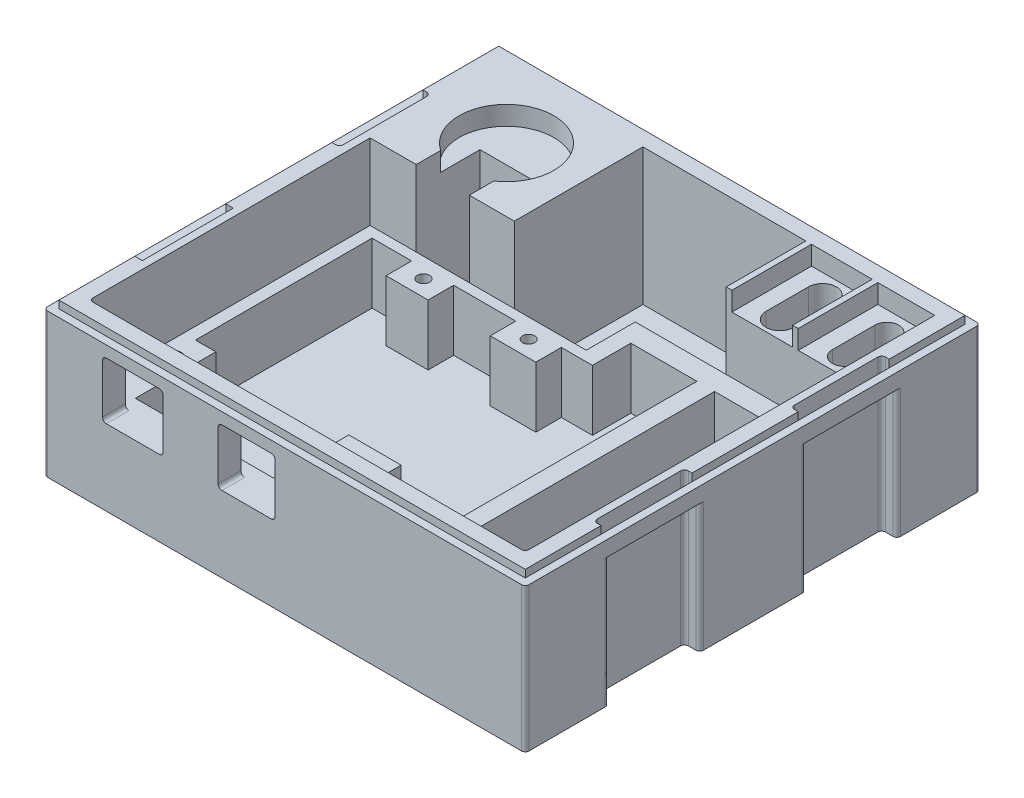
from build123d import *

# Parameters (mm, degrees)
CROQUIS1_W                       = 127
CROQUIS1_H                       = 120
SALIENTE_EXTRUIR1_DEPTH          = 40
CROQUIS2_W                       = 115
CROQUIS2_H                       = 108
CORTAR_EXTRUIR1_DEPTH            = 20
CROQUIS15_W                      = 16
CROQUIS15_H                      = 15
CORTAR_EXTRUIR3_DEPTH            = 14
REDONDEO4_R                      = 1
REDONDEO5_R                      = 1
TALADRO_DE_MARGEN_PARA_M31_D     = 3.2
TALADRO_DE_MARGEN_PARA_M31_DEPTH = 15
TALADRO_DE_MARGEN_PARA_M31_TIP   = 0.96137699
SALIENTE_EXTRUIR4_DEPTH          = 15
CROQUIS22_W                      = 1.5
CROQUIS22_H                      = 21
SALIENTE_EXTRUIR5_DEPTH          = 5
CROQUIS24_W                      = 38.033070537
CROQUIS24_H                      = 33.923090476
CROQUIS24_R                      = 12.5
SALIENTE_EXTRUIR8_DEPTH          = 5
CROQUIS25_W                      = 14
CROQUIS25_H                      = 6.45894104
CORTAR_EXTRUIR4_DEPTH            = 5
CROQUIS27_W                      = 14
CROQUIS27_H                      = 16.815098629
CORTAR_EXTRUIR5_DEPTH            = 84.1
CROQUIS28_W                      = 15
CROQUIS28_H                      = 15
CORTAR_EXTRUIR6_DEPTH            = 10
REDONDEO7_R                      = 1
CROQUIS32_OUTSIDE_W              = 164.85
CROQUIS32_OUTSIDE_H              = 157.85
CROQUIS32_OUTSIDE_W_2            = 123
CROQUIS32_OUTSIDE_H_2            = 116
CORTAR_EXTRUIR7_DEPTH            = 2
CROQUIS34_W                      = 24
CROQUIS34_H                      = 34
CORTAR_EXTRUIR8_DEPTH            = 4
CROQUIS35_W                      = 2
CROQUIS35_H                      = 24
CORTAR_EXTRUIR9_DEPTH            = 20
REDONDEO13_R                     = 1
REDONDEO19_R                     = 1
REDONDEO14_R                     = 1
CROQUIS36_R                      = 2.5
CORTAR_EXTRUIR10_DEPTH           = 1
CORTAR_EXTRUIR14_DEPTH           = 39
CROQUIS45_W                      = 25.554294357
CROQUIS45_H                      = 77.944282849
CORTAR_EXTRUIR15_DEPTH           = 16
CORTAR_EXTRUIR16_DEPTH           = 31


with BuildPart() as part:
    # Croquis1 → Saliente-Extruir1 (new body)
    with BuildSketch(Plane(origin=(0, 0, 0), x_dir=(1, 0, 0), z_dir=(0, 1, 0))):
        with Locations((12.465540006, -22.149251677)):
            Rectangle(CROQUIS1_W, CROQUIS1_H)
    extrude(amount=SALIENTE_EXTRUIR1_DEPTH)

    # Croquis2 → Cortar-Extruir1 (cut)
    with BuildSketch(Plane(origin=(0, 40, 0), x_dir=(1, 0, 0), z_dir=(0, 1, 0))):
        with Locations((12.465540006, -22.149251677)):
            Rectangle(CROQUIS2_W, CROQUIS2_H)
    extrude(amount=-CORTAR_EXTRUIR1_DEPTH, mode=Mode.SUBTRACT)

    # Croquis15 → Cortar-Extruir3 (cut)
    with BuildSketch(Plane(origin=(0, 0, 76.149251677), x_dir=(-1, 0, 0), z_dir=(0, 0, -1))):
        with Locations((27.534459994, 27.5)):
            Rectangle(CROQUIS15_W, CROQUIS15_H)
    extrude(amount=-CORTAR_EXTRUIR3_DEPTH, mode=Mode.SUBTRACT)

    # Redondeo4
    redondeo4_edges = [part.edges().sort_by_distance(p)[0] for p in [
        (-35.534459994, 35, 79.149251677),
        (-35.534459994, 20, 79.149251677),
        (-19.534459994, 20, 79.149251677),
        (-19.534459994, 35, 79.149251677),
    ]]
    fillet(redondeo4_edges, radius=REDONDEO4_R)

    # Redondeo5
    redondeo5_edges = [part.edges().sort_by_distance(p)[0] for p in [
        (-45.034459994, 30, 76.149251677),
        (69.965540006, 30, 76.149251677),
    ]]
    fillet(redondeo5_edges, radius=REDONDEO5_R)

    # Taladro de margen para M31
    with Locations(Plane(origin=(0, 20, 0), x_dir=(1, 0, 0), z_dir=(0, 1, 0))):
        with Locations((-41.034459994, -57.549251677), (6.965509678, -59.149251677), (-25.815009056, -7.199797633), (1.865509678, -7.156454516)):
            Hole(TALADRO_DE_MARGEN_PARA_M31_D / 2, depth=TALADRO_DE_MARGEN_PARA_M31_DEPTH)
            with Locations((0, 0, -(TALADRO_DE_MARGEN_PARA_M31_DEPTH + TALADRO_DE_MARGEN_PARA_M31_TIP / 2))):  # 118° drill point
                Cone(0, TALADRO_DE_MARGEN_PARA_M31_D / 2, TALADRO_DE_MARGEN_PARA_M31_TIP, mode=Mode.SUBTRACT)

    # Croquis21 → Saliente-Extruir4 (add)
    with BuildSketch(Plane(origin=(0, 20, 0), x_dir=(1, 0, 0), z_dir=(0, 1, 0))):
        Polygon((-45.034459994, -2.072342153), (11.965540006, -2.072342153), (11.965540006, 10.850748323), (69.965540006, 10.850748323), (69.965540006, 31.850748323), (-45.034459994, 31.850748323), align=None)
    extrude(amount=SALIENTE_EXTRUIR4_DEPTH)

    # Croquis22 → Saliente-Extruir5 (add)
    with BuildSketch(Plane(origin=(0, 35, 0), x_dir=(1, 0, 0), z_dir=(0, 1, 0))):
        with Locations((54.215540006, 21.350748323)):
            Rectangle(CROQUIS22_W, CROQUIS22_H)
        with Locations((36.715540006, 21.350748323)):
            Rectangle(CROQUIS22_W, CROQUIS22_H)
    extrude(amount=SALIENTE_EXTRUIR5_DEPTH)

    # Croquis24 → Saliente-Extruir8 (add)
    with BuildSketch(Plane(origin=(0, 35, 0), x_dir=(1, 0, 0), z_dir=(0, 1, 0))):
        with Locations((-26.017924726, 14.889203085)):
            Rectangle(CROQUIS24_W, CROQUIS24_H)
        with Locations(Location((-25.871478116, 14.742756476, 0), (0, 0, 270))):
            Circle(CROQUIS24_R, mode=Mode.SUBTRACT)
    extrude(amount=SALIENTE_EXTRUIR8_DEPTH)

    # Croquis25 → Cortar-Extruir4 (cut)
    with BuildSketch(Plane(origin=(0, 40, 0), x_dir=(1, 0, 0), z_dir=(0, 1, 0))):
        with Locations((-25.871478116, 1.157128367)):
            Rectangle(CROQUIS25_W, CROQUIS25_H)
    extrude(amount=-CORTAR_EXTRUIR4_DEPTH, mode=Mode.SUBTRACT)

    # Croquis27 → Cortar-Extruir5 (cut)
    with BuildSketch(Plane(origin=(0, 35, 0), x_dir=(1, 0, 0), z_dir=(0, 1, 0))):
        with Locations((-25.871478116, 6.335207161)):
            Rectangle(CROQUIS27_W, CROQUIS27_H)
    extrude(amount=-CORTAR_EXTRUIR5_DEPTH, mode=Mode.SUBTRACT)

    # Croquis28 → Cortar-Extruir6 (cut)
    with BuildSketch(Plane.XY.offset(82.149251677)):
        with Locations((2.465540006, 27.5)):
            Rectangle(CROQUIS28_W, CROQUIS28_H)
    extrude(amount=-CORTAR_EXTRUIR6_DEPTH, mode=Mode.SUBTRACT)

    # Redondeo7
    redondeo7_edges = [part.edges().sort_by_distance(p)[0] for p in [
        (-5.034459994, 20, 79.149251677),
        (-5.034459994, 35, 79.149251677),
        (9.965540006, 35, 79.149251677),
        (9.965540006, 20, 79.149251677),
    ]]
    fillet(redondeo7_edges, radius=REDONDEO7_R)

    # Croquis32 outside → Cortar-Extruir7 (cut)
    with BuildSketch(Plane(origin=(0, 40, 0), x_dir=(1, 0, 0), z_dir=(0, 1, 0))):
        with Locations((12.466, -22.149)):
            Rectangle(CROQUIS32_OUTSIDE_W, CROQUIS32_OUTSIDE_H)
        with Locations((12.465540006, -22.149251677)):
            Rectangle(CROQUIS32_OUTSIDE_W_2, CROQUIS32_OUTSIDE_H_2, mode=Mode.SUBTRACT)
    extrude(amount=-CORTAR_EXTRUIR7_DEPTH, mode=Mode.SUBTRACT)

    # Croquis34 → Cortar-Extruir8 (cut)
    with BuildSketch(Plane(origin=(75.965540006, 0, 0), x_dir=(0, 0, -1), z_dir=(1, 0, 0))):
        with Locations((-48.149251677, 17)):
            Rectangle(CROQUIS34_W, CROQUIS34_H)
        with Locations((3.850748323, 17)):
            Rectangle(CROQUIS34_W, CROQUIS34_H)
    cortar_extruir8 = extrude(amount=-CORTAR_EXTRUIR8_DEPTH, mode=Mode.SUBTRACT)

    # Croquis35 → Cortar-Extruir9 (cut)
    with BuildSketch(Plane.XZ.offset(-34)):
        with Locations((72.965540006, 48.149251677)):
            Rectangle(CROQUIS35_W, CROQUIS35_H)
        with Locations((72.965540006, -3.850748323)):
            Rectangle(CROQUIS35_W, CROQUIS35_H)
    cortar_extruir9 = extrude(amount=-CORTAR_EXTRUIR9_DEPTH, mode=Mode.SUBTRACT)

    # Redondeo13
    redondeo13_edges = [part.edges().sort_by_distance(p)[0] for p in [
        (71.965540006, 20, 60.149251677),
        (71.965540006, 20, 36.149251677),
        (75.965540006, 17, 60.149251677),
        (75.965540006, 17, 36.149251677),
        (71.965540006, 20, 8.149251677),
        (71.965540006, 20, -15.850748323),
        (75.965540006, 17, 8.149251677),
        (75.965540006, 17, -15.850748323),
    ]]
    fillet(redondeo13_edges, radius=REDONDEO13_R)

    # Simetría2: Cortar-Extruir8, Cortar-Extruir9 across plane
    add(cortar_extruir8.mirror(Plane(origin=(12.465540006, 0, 0), x_dir=(0, 0, 1), z_dir=(1, 0, 0))), mode=Mode.SUBTRACT)
    add(cortar_extruir9.mirror(Plane(origin=(12.465540006, 0, 0), x_dir=(0, 0, 1), z_dir=(1, 0, 0))), mode=Mode.SUBTRACT)

    # Redondeo19
    redondeo19_edges = [part.edges().sort_by_distance(p)[0] for p in [
        (-51.034459994, 17, 60.149251677),
        (-51.034459994, 17, 36.149251677),
        (-51.034459994, 17, 8.149251677),
        (-51.034459994, 17, -15.850748323),
        (-47.034459994, 20, 8.149251677),
        (-47.034459994, 20, -15.850748323),
    ]]
    fillet(redondeo19_edges, radius=REDONDEO19_R)

    # Redondeo14
    redondeo14_edges = [part.edges().sort_by_distance(p)[0] for p in [
        (-51.034459994, 19, 82.149251677),
        (-51.034459994, 19, -37.850748323),
        (75.965540006, 19, -37.850748323),
        (75.965540006, 19, 82.149251677),
    ]]
    fillet(redondeo14_edges, radius=REDONDEO14_R)

    # Croquis36 → Cortar-Extruir10 (cut)
    with BuildSketch(Plane(origin=(0, 0, 0), x_dir=(-1, 0, 0), z_dir=(0, -1, 0))):
        with Locations(Location((-12.465540006, -58.149251677, 0), (0, 0, 90))):
            Circle(CROQUIS36_R)
        with Locations(Location((-12.465540006, 13.850748323, 0), (0, 0, 90))):
            Circle(CROQUIS36_R)
        with Locations(Location((-12.465540006, -10.149251677, 0), (0, 0, 90))):
            Circle(CROQUIS36_R)
        with Locations(Location((-12.465540006, -34.149251677, 0), (0, 0, 90))):
            Circle(CROQUIS36_R)
    extrude(amount=-CORTAR_EXTRUIR10_DEPTH, mode=Mode.SUBTRACT)

    # Croquis44 → Cortar-Extruir14 (cut)
    with BuildSketch(Plane(origin=(0, 35, 0), x_dir=(1, 0, 0), z_dir=(0, 1, 0))):
        with BuildLine():
            Line((49.133290382, 26.728304647), (49.133290382, 15.518377593))
            ThreePointArc((49.133290382, 15.518377593), (45.465540006, 11.850627217), (41.797789631, 15.518377593))
            Line((41.797789631, 15.518377593), (41.797789631, 26.728304647))
            ThreePointArc((41.797789631, 26.728304647), (45.465540006, 30.396055022), (49.133290382, 26.728304647))
        make_face()
        with BuildLine():
            Line((65.633290382, 26.728304647), (65.633290382, 15.518377593))
            ThreePointArc((65.633290382, 15.518377593), (62.465540006, 12.350627217), (59.297789631, 15.518377593))
            Line((59.297789631, 15.518377593), (59.297789631, 26.728304647))
            ThreePointArc((59.297789631, 26.728304647), (62.465540006, 29.896055022), (65.633290382, 26.728304647))
        make_face()
    extrude(amount=-CORTAR_EXTRUIR14_DEPTH, mode=Mode.SUBTRACT)

    # Croquis45 → Cortar-Extruir15 (cut)
    with BuildSketch(Plane(origin=(0, 20, 0), x_dir=(1, 0, 0), z_dir=(0, 1, 0))):
        Polygon((-31.458080568, -4.711128446), (-31.458080568, -11.448349249), (-20.361481599, -11.448349249), (-20.361481599, -4.711128446), (-3.980787883, -4.711128446), (-3.980787883, -11.448349249), (8.040527667, -11.448349249), (8.040527667, -4.711128446), (16.230874525, -4.711128446), (16.230874525, 5.427258738), (33.668387191, 5.427258738), (33.668387191, -72.517024111), (13.808026092, -72.517024111), (13.808026092, -52.728826942), (0, -52.728826942), (0, -72.517024111), (-36.514276642, -72.517024111), (-36.514276642, -51.287302645), (-41.88723084, -51.287302645), (-41.88723084, -4.711128446), align=None)
        with Locations((51.091086321, -33.544882686)):
            Rectangle(CROQUIS45_W, CROQUIS45_H)
    extrude(amount=-CORTAR_EXTRUIR15_DEPTH, mode=Mode.SUBTRACT)

    # Croquis46 → Cortar-Extruir16 (cut)
    with BuildSketch(Plane(origin=(0, 35, 0), x_dir=(1, 0, 0), z_dir=(0, 1, 0))):
        Polygon((-7.001389457, 31.850748323), (35.965540006, 31.850748323), (35.965540006, 10.850748323), (11.965540006, 10.850748323), (11.965540006, -2.072342153), (-7.001389457, -2.072342153), align=None)
    extrude(amount=-CORTAR_EXTRUIR16_DEPTH, mode=Mode.SUBTRACT)


solid = part.part
